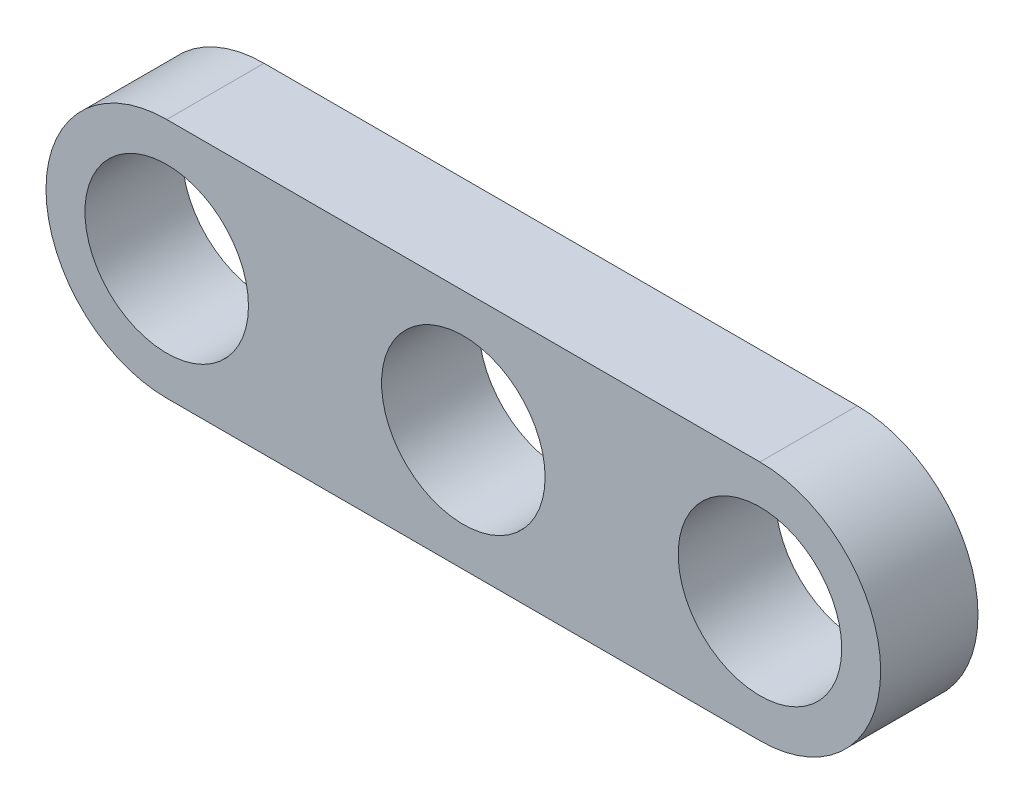
from build123d import *

# Parameters (mm, degrees)
SKETCH_1_R      = 4.2
EXTRUDE_1_DEPTH = 5


with BuildPart() as part:
    # Эскиз1 → Бобышка-Вытянуть1 (new body)
    with BuildSketch(Plane.XY):
        with BuildLine():
            Line((-15.237041181, 6.2), (15.237041181, 6.2))
            ThreePointArc((15.237041181, 6.2), (21.437041181, 0), (15.237041181, -6.2))
            Line((15.237041181, -6.2), (-15.237041181, -6.2))
            ThreePointArc((-15.237041181, -6.2), (-21.437041181, 0), (-15.237041181, 6.2))
        make_face()
        with Locations((-15.237041181, 0)):
            Circle(SKETCH_1_R, mode=Mode.SUBTRACT)
        Circle(SKETCH_1_R, mode=Mode.SUBTRACT)
        with Locations((15.237041181, 0)):
            Circle(SKETCH_1_R, mode=Mode.SUBTRACT)
    extrude(amount=EXTRUDE_1_DEPTH)


solid = part.part
